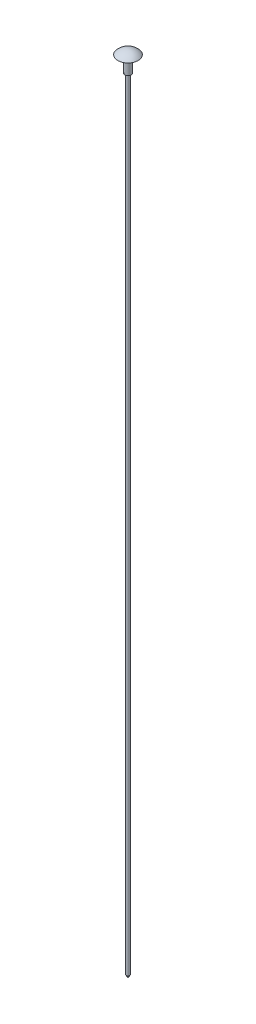
from build123d import *


with BuildPart() as part:
    # Sketch1 → Revolve1 (revolve)
    with BuildSketch(Plane.XY, mode=Mode.PRIVATE) as revolve1_sk:
        with BuildLine():
            Line((-5.9055, 1300), (-5.9055, -1289.771373956))
            Line((-5.9055, -1289.771373956), (0, -1300))
            Line((0, -1300), (0, 1300))
            Line((0, 1300), (0, 1367.456844549))
            ThreePointArc((0, 1367.456844549), (-18.39217744, 1363.659264489), (-33.776137717, 1352.887654978))
            Line((-33.776137717, 1352.887654978), (-10.77842937, 1352.887654978))
            Line((-10.77842937, 1352.887654978), (-10.77842937, 1300))
            Line((-10.77842937, 1300), (-5.9055, 1300))
        make_face()
    revolve(revolve1_sk.sketch.rotate(Axis((0, 1300, 0), (0, 1, 0)), 270), axis=Axis((0, 1300, 0), (0, 1, 0)))


solid = part.part
